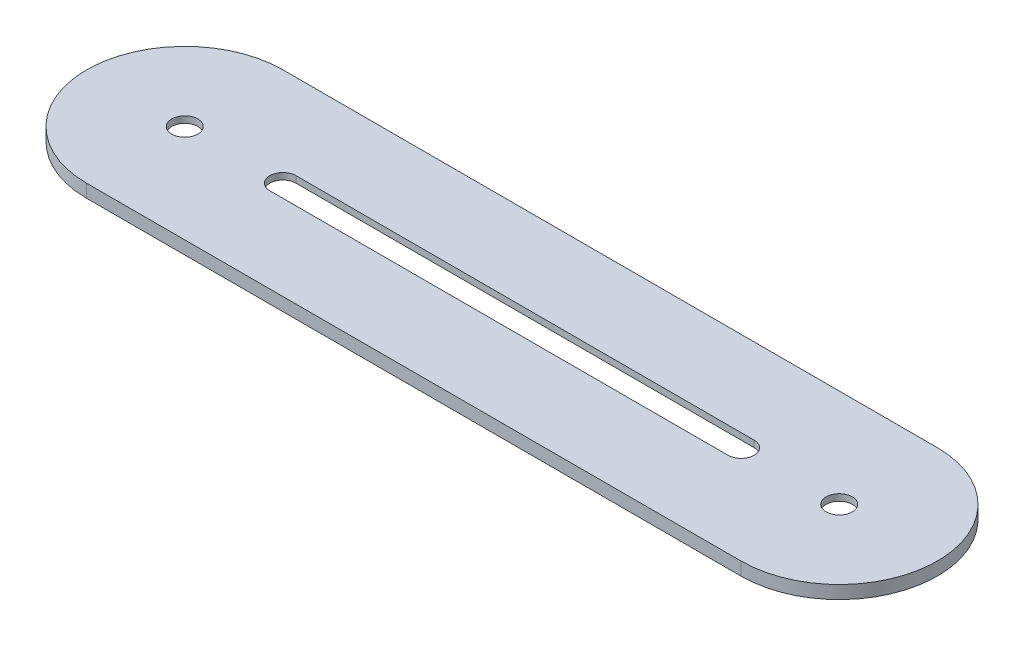
from build123d import *

# Parameters (mm, degrees)
SKETCH1_R           = 10
BOSS_EXTRUDE1_DEPTH = 5
CUT_EXTRUDE1_DEPTH  = 5


with BuildPart() as part:
    # Sketch1 → Boss-Extrude1 (new, symmetric)
    with BuildSketch(Plane(origin=(0, 0, 0), x_dir=(-1, 0, 0), z_dir=(0, 1, 0))):
        with BuildLine():
            Line((-250, 75), (250, 75))
            ThreePointArc((250, 75), (325, 0), (250, -75))
            Line((250, -75), (-250, -75))
            ThreePointArc((-250, -75), (-325, 0), (-250, 75))
        make_face()
        with Locations(Location((250, 0, 0), (0, 0, 90))):
            Circle(SKETCH1_R, mode=Mode.SUBTRACT)
        with Locations(Location((-250, 0, 0), (0, 0, 270))):
            Circle(SKETCH1_R, mode=Mode.SUBTRACT)
        with BuildLine():
            Line((-175, 10), (175, 10))
            ThreePointArc((175, 10), (185, 0), (175, -10))
            Line((175, -10), (-175, -10))
            ThreePointArc((-175, -10), (-185, 0), (-175, 10))
        make_face(mode=Mode.SUBTRACT)
    extrude(amount=BOSS_EXTRUDE1_DEPTH, both=True)

    # Sketch4 → Cut-Extrude1 (cut)
    with BuildSketch(Plane.XZ.offset(5)):
        with BuildLine():
            Line((250, 72), (-250, 72))
            ThreePointArc((-250, 72), (-322, 0), (-250, -72))
            Line((-250, -72), (250, -72))
            ThreePointArc((250, -72), (322, 0), (250, 72))
        make_face()
    extrude(amount=-CUT_EXTRUDE1_DEPTH, mode=Mode.SUBTRACT)


solid = part.part
